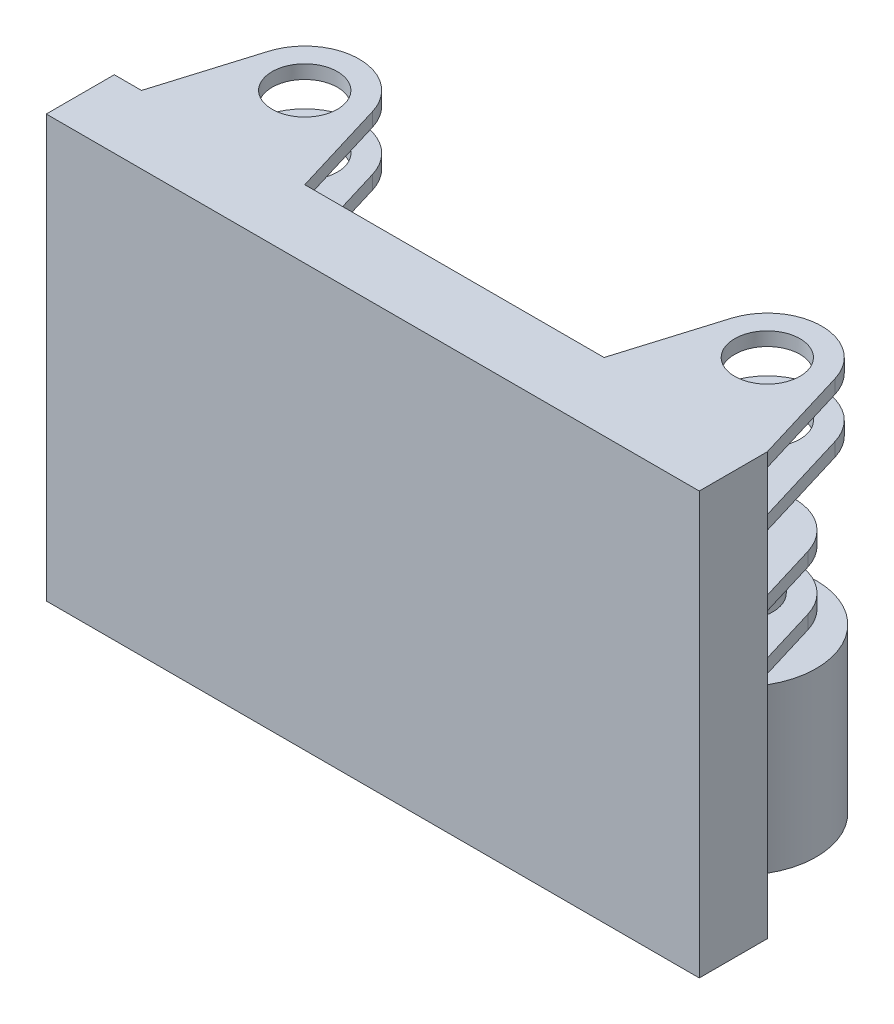
from build123d import *

# Parameters (mm, degrees)
SKETCH_1_W           = 240
SKETCH_1_H           = 85
EXTRUDE_1_DEPTH      = 25
SKETCH_2_R           = 12
EXTRUDE_2_DEPTH      = 25
SKETCH_3_W           = 233.337502947
SKETCH_3_H           = 53.700186647
CUT_EXTRUDE_1_DEPTH  = 15
SKETCH_4_R           = 12
EXTRUDE_3_DEPTH      = 25
SKETCH_5_W           = 240.131792842
SKETCH_5_H           = 54.002866145
CUT_EXTRUDE_2_DEPTH  = 15
EXTRUDE_4_DEPTH      = 5
EXTRUDE_4_DEPTH_BACK = 25
SKETCH_6_R           = 12
SKETCH_8_R           = 28
EXTRUDE_5_DEPTH      = 60
SKETCH_9_W           = 240
SKETCH_9_H           = 25
EXTRUDE_6_DEPTH      = 70
SKETCH_10_W          = 36
SKETCH_10_H          = 40
EXTRUDE_7_DEPTH      = 15
SKETCH_11_R          = 10
CUT_EXTRUDE_3_DEPTH  = 10


with BuildPart() as part:
    # 草图1 → 凸台-拉伸1 (new body)
    with BuildSketch(Plane.XY):
        with Locations((120, 42.5)):
            Rectangle(SKETCH_1_W, SKETCH_1_H)
    extrude(amount=EXTRUDE_1_DEPTH)

    # 草图2 → 凸台-拉伸2 (add)
    # profile 1 of 2: a face of its own
    with BuildSketch(Plane.XZ):
        with BuildLine():
            Line((0, 0), (30, 0))
            Line((30, 0), (60, 0))
            Line((60, 0), (49.138858248, -35.805524564))
            ThreePointArc((49.138858248, -35.805524564), (30, -50.000000263), (10.861141752, -35.805524564))
            Line((10.861141752, -35.805524564), (0, 0))
        make_face()
        with Locations(Location((30, -30, 0), (0, 0, 270))):
            Circle(SKETCH_2_R, mode=Mode.SUBTRACT)
    # profile 2 of 2: a face of its own
    with BuildSketch(Plane.XZ):
        with BuildLine():
            Line((170, 0), (230, 0))
            Line((230, 0), (219.138858248, -35.805524564))
            ThreePointArc((219.138858248, -35.805524564), (200, -50.000000263), (180.861141752, -35.805524564))
            Line((180.861141752, -35.805524564), (170, 0))
        make_face()
        with Locations(Location((200, -30, 0), (0, 0, 270))):
            Circle(SKETCH_2_R, mode=Mode.SUBTRACT)
    extrude(amount=-EXTRUDE_2_DEPTH)

    # 草图3 → 切除-拉伸1 (cut)
    with BuildSketch(Plane(origin=(0, 5, 0), x_dir=(-1, 0, 0), z_dir=(0, -1, 0))):
        with Locations((-113.331248527, 26.850093324)):
            Rectangle(SKETCH_3_W, SKETCH_3_H)
    extrude(amount=-CUT_EXTRUDE_1_DEPTH, mode=Mode.SUBTRACT)

    # 草图4 → 凸台-拉伸3 (add)
    # profile 1 of 2: a face of its own
    with BuildSketch(Plane(origin=(0, 85, 0), x_dir=(1, 0, 0), z_dir=(0, 1, 0))):
        with BuildLine():
            Line((20.861141752, 35.805524564), (10, 0))
            Line((10, 0), (70, 0))
            Line((70, 0), (59.138858248, 35.805524564))
            ThreePointArc((59.138858248, 35.805524564), (40, 50.000000263), (20.861141752, 35.805524564))
        make_face()
        with Locations(Location((40, 30, 0), (0, 0, 270))):
            Circle(SKETCH_4_R, mode=Mode.SUBTRACT)
    # profile 2 of 2: a face of its own
    with BuildSketch(Plane(origin=(0, 85, 0), x_dir=(1, 0, 0), z_dir=(0, 1, 0))):
        with BuildLine():
            Line((190.861141752, 35.805524564), (180, 0))
            Line((180, 0), (240, 0))
            Line((240, 0), (229.138858248, 35.805524564))
            ThreePointArc((229.138858248, 35.805524564), (210, 50.000000263), (190.861141752, 35.805524564))
        make_face()
        with Locations(Location((210, 30, 0), (0, 0, 270))):
            Circle(SKETCH_4_R, mode=Mode.SUBTRACT)
    extrude(amount=-EXTRUDE_3_DEPTH)

    # 草图5 → 切除-拉伸2 (cut)
    with BuildSketch(Plane(origin=(0, 80, 0), x_dir=(1, 0, 0), z_dir=(0, 1, 0))):
        with Locations((130.065896421, 27.001433073)):
            Rectangle(SKETCH_5_W, SKETCH_5_H)
    extrude(amount=-CUT_EXTRUDE_2_DEPTH, mode=Mode.SUBTRACT)

    # 草图6 → 凸台-拉伸4 (add, two sides: drawn at the far end of the back side and taken through both)
    with BuildSketch(Plane.XZ.offset(-EXTRUDE_4_DEPTH_BACK)):
        with Locations(Location((200, -30, 0), (0, 0, 90))):
            Circle(SKETCH_6_R)
    extrude(amount=EXTRUDE_4_DEPTH + EXTRUDE_4_DEPTH_BACK)

    # 草图8 → 凸台-拉伸5 (add)
    with BuildSketch(Plane.XZ.offset(5)):
        with Locations(Location((200, -30, 0), (0, 0, 270))):
            Circle(SKETCH_8_R)
    extrude(amount=EXTRUDE_5_DEPTH)

    # 草图9 → 凸台-拉伸6 (add)
    with BuildSketch(Plane.XZ):
        with Locations((120, 12.5)):
            Rectangle(SKETCH_9_W, SKETCH_9_H)
    extrude(amount=EXTRUDE_6_DEPTH)

    # 草图10 → 凸台-拉伸7 (add)
    with BuildSketch(Plane(origin=(0, 0, 0), x_dir=(-1, 0, 0), z_dir=(0, 0, -1))):
        with Locations((-200, -35)):
            Rectangle(SKETCH_10_W, SKETCH_10_H)
    extrude(amount=EXTRUDE_7_DEPTH)

    # 草图11 → 切除-拉伸3 (cut)
    with BuildSketch(Plane.XZ.offset(70)):
        with Locations(Location((50, 12.5, 0), (0, 0, 270))):
            Circle(SKETCH_11_R)
        with Locations(Location((190, 12.5, 0), (0, 0, 270))):
            Circle(SKETCH_11_R)
    extrude(amount=-CUT_EXTRUDE_3_DEPTH, mode=Mode.SUBTRACT)


solid = part.part
